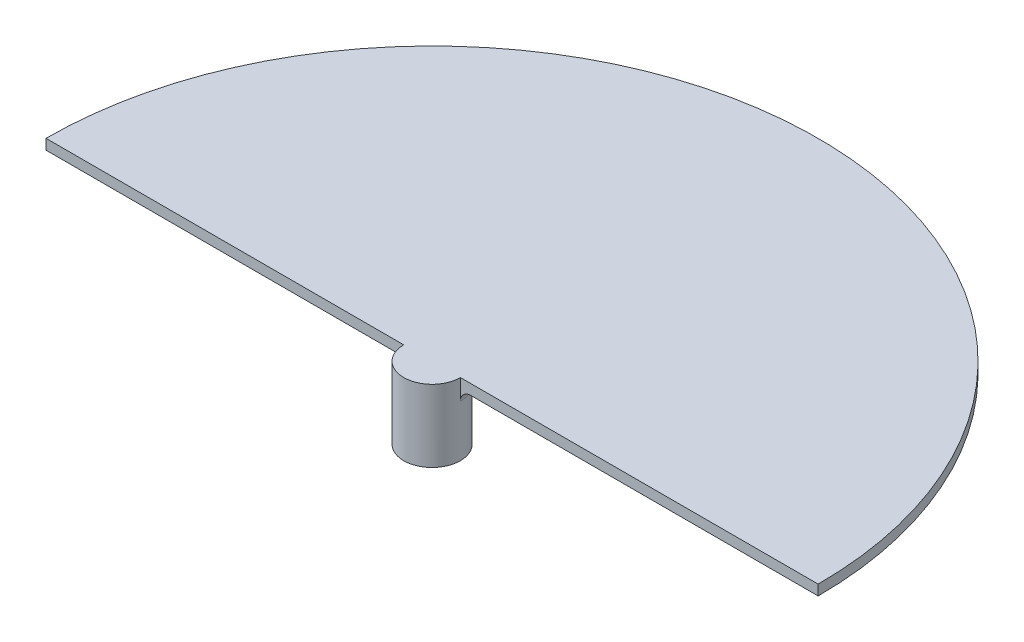
from build123d import *

# Parameters (mm, degrees)
BOSS_EXTRUDE1_DEPTH = 1
SKETCH3_R           = 2.75
BOSS_EXTRUDE2_DEPTH = 7
FILLET1_R           = 1


with BuildPart() as part:
    # Sketch1 → Boss-Extrude1 (new body)
    with BuildSketch(Plane(origin=(0, 0, 0), x_dir=(1, 0, 0), z_dir=(0, 1, 0))):
        with BuildLine():
            Line((-37.5, 0), (37.5, 0))
            ThreePointArc((37.5, 0), (0, 37.5), (-37.5, 0))
        make_face()
    extrude(amount=BOSS_EXTRUDE1_DEPTH)

    # Sketch3 → Boss-Extrude2 (add)
    with BuildSketch(Plane(origin=(0, 1, 0), x_dir=(1, 0, 0), z_dir=(0, 1, 0))):
        with Locations(Location((0, 0, 0), (0, 0, 270))):
            Circle(SKETCH3_R)
    extrude(amount=-BOSS_EXTRUDE2_DEPTH)

    # Fillet1
    fillet1_edges = [part.edges().sort_by_distance(p)[0] for p in [
        (0, 0, -2.75),
    ]]
    fillet(fillet1_edges, radius=FILLET1_R)


solid = part.part
